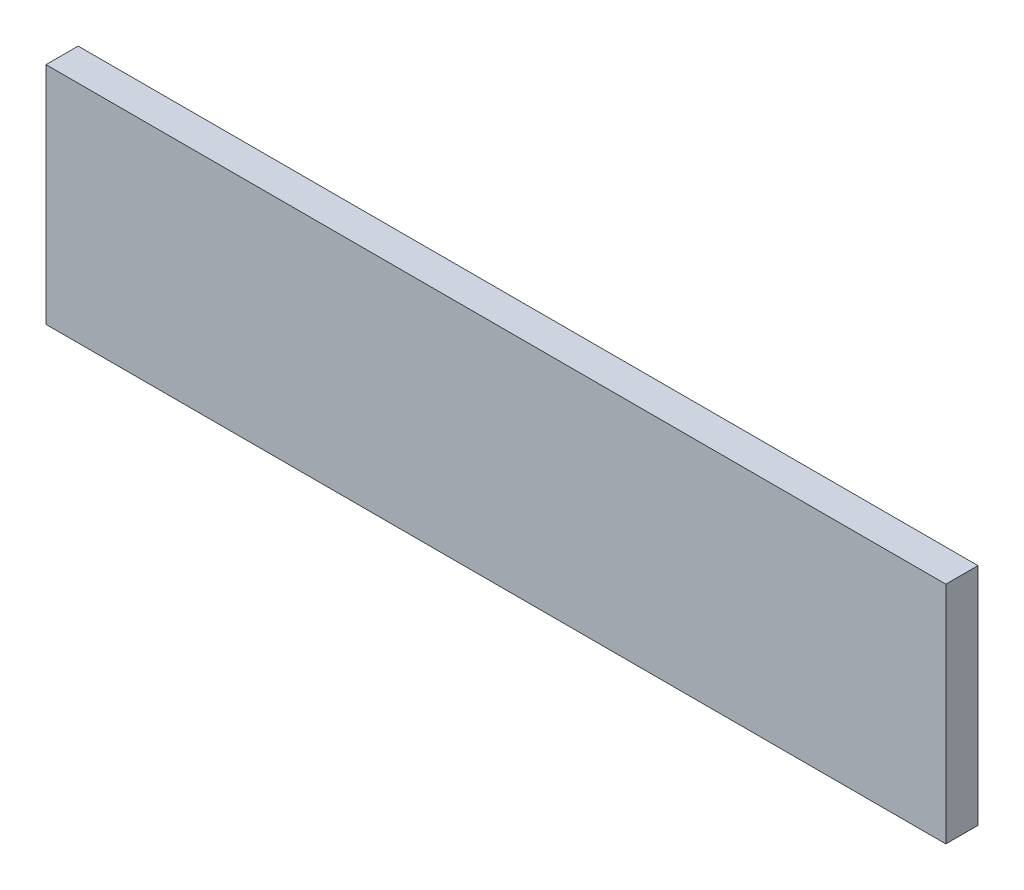
from build123d import *

# Parameters (mm, degrees)
SKETCH1_W           = 280
SKETCH1_H           = 70
BOSS_EXTRUDE1_DEPTH = 10


with BuildPart() as part:
    # Sketch1 → Boss-Extrude1 (new body)
    with BuildSketch(Plane.XY):
        Rectangle(SKETCH1_W, SKETCH1_H)
    extrude(amount=BOSS_EXTRUDE1_DEPTH)


solid = part.part
